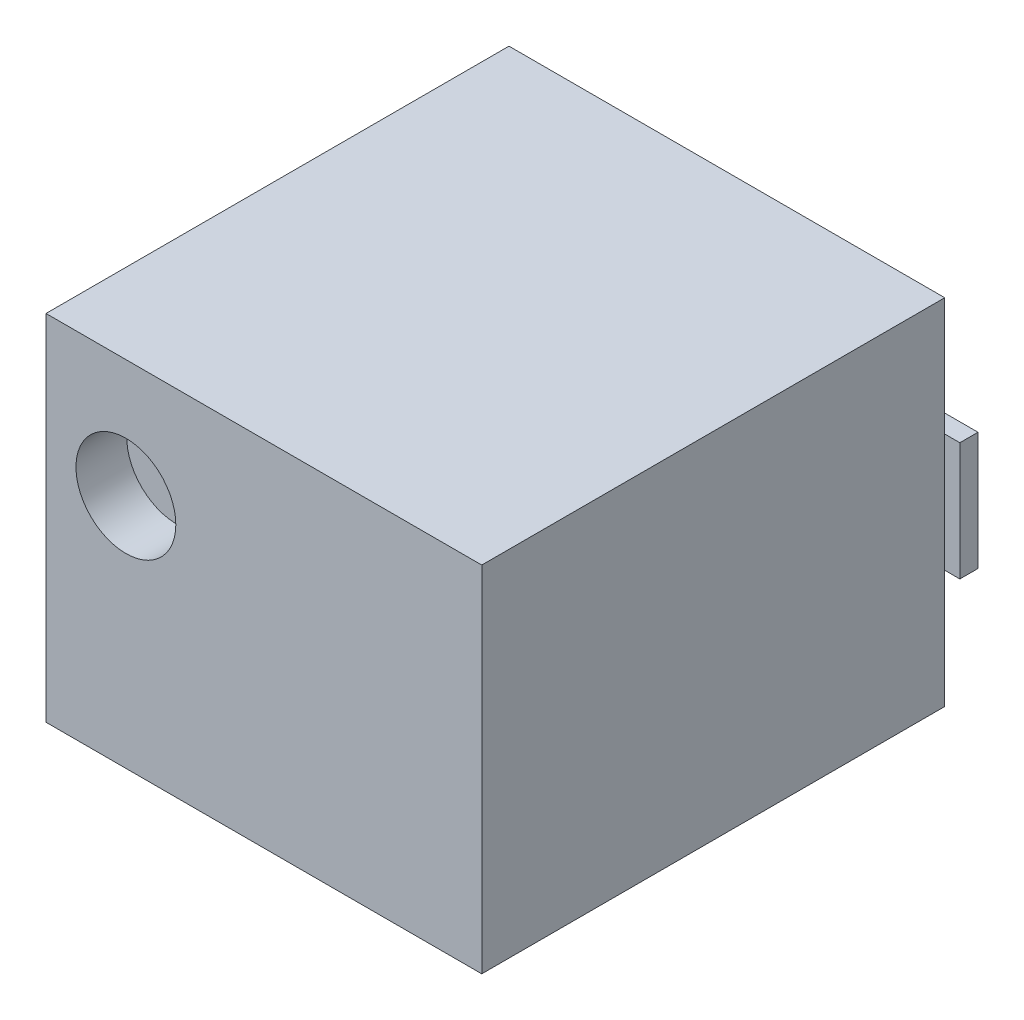
from build123d import *

# Parameters (mm, degrees)
EXTRUDE_1_DEPTH      = 1.95
EXTRUDE_1_DEPTH_BACK = 1.95
SKETCH_1_W           = 4.8
SKETCH_1_H           = 5.1
SKETCH_4_R           = 0.55
CUT_EXTRUDE_1_DEPTH  = 0.56
SKETCH_5_W           = 1.288637745
SKETCH_5_H           = 1.3
SKETCH_5_W_2         = 1.014010029
SKETCH_5_H_2         = 0.602068455
EXTRUDE_1_2_DEPTH    = 0.2


with BuildPart() as part:
    # 草图1 → Extrude 1 (new, two sides: drawn at the far end of the back side and taken through both)
    with BuildSketch(Plane(origin=(0, 0, 0), x_dir=(1, 0, 0), z_dir=(0, 1, 0)).offset(-EXTRUDE_1_DEPTH_BACK)):
        Rectangle(SKETCH_1_W, SKETCH_1_H)
    extrude(amount=EXTRUDE_1_DEPTH + EXTRUDE_1_DEPTH_BACK)

    # 草图4 → 切除-拉伸1 (cut)
    with BuildSketch(Plane.XY.offset(2.55)):
        with Locations((-1.52, 0.65)):
            Circle(SKETCH_4_R)
    extrude(amount=-CUT_EXTRUDE_1_DEPTH, mode=Mode.SUBTRACT)

    # 草图5 → Extrude 1 2 (add)
    with BuildSketch(Plane(origin=(0, 0, -2.55), x_dir=(-1, 0, 0), z_dir=(0, 0, -1))):
        with Locations((-1.922058583, 0)):
            Rectangle(SKETCH_5_W, SKETCH_5_H)
        with Locations((2.092994985, 1.359060107)):
            Rectangle(SKETCH_5_W_2, SKETCH_5_H_2)
        with Locations((2.092994985, -1.359060107)):
            Rectangle(SKETCH_5_W_2, SKETCH_5_H_2)
    extrude(amount=EXTRUDE_1_2_DEPTH)


solid = part.part
